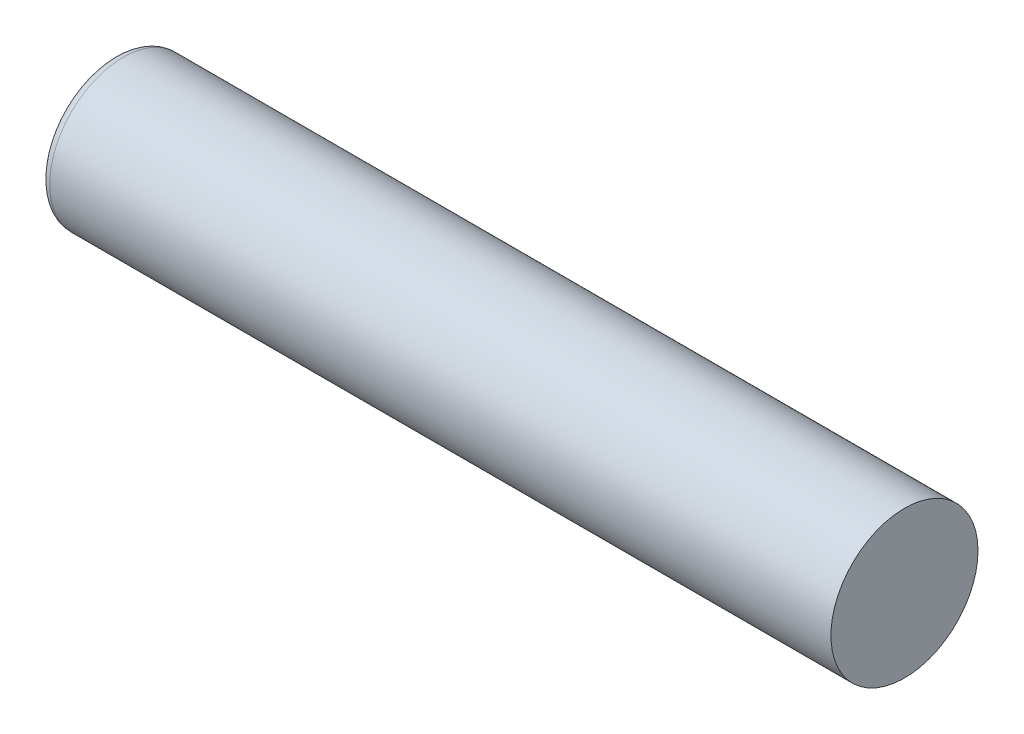
from build123d import *

# Parameters (mm, degrees)
CROQUIS5_R              = 4
SALIENTE_EXTRUIR2_DEPTH = 3
CROQUIS6_R              = 4
SALIENTE_EXTRUIR3_DEPTH = 40
REDONDEO1_R             = 0.5


with BuildPart() as part:
    # Croquis5 → Saliente-Extruir2 (new body)
    with BuildSketch(Plane(origin=(0, 0, 0), x_dir=(0, 0, -1), z_dir=(1, 0, 0))):
        Circle(CROQUIS5_R)
    extrude(amount=SALIENTE_EXTRUIR2_DEPTH)

    # Croquis6 → Saliente-Extruir3 (add)
    with BuildSketch(Plane(origin=(3, 0, 0), x_dir=(0, 0, -1), z_dir=(1, 0, 0))):
        Circle(CROQUIS6_R)
    extrude(amount=SALIENTE_EXTRUIR3_DEPTH)

    # Redondeo1
    redondeo1_edges = [part.edges().sort_by_distance(p)[0] for p in [
        (0, 0, 4),
    ]]
    fillet(redondeo1_edges, radius=REDONDEO1_R)


solid = part.part
